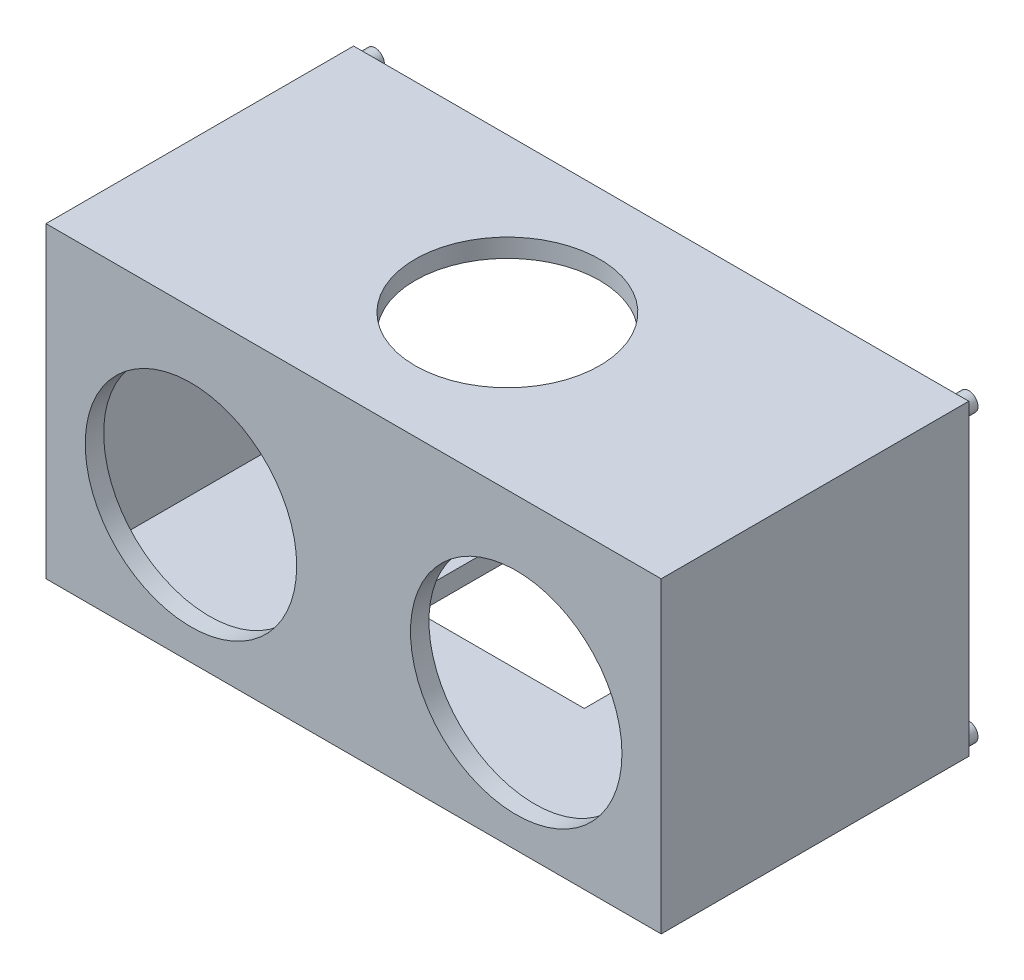
from build123d import *

# Parameters (mm, degrees)
SKETCH1_W               = 50.8
SKETCH1_H               = 25.4
BOSS_EXTRUDE1_DEPTH     = 25.4
SHELL1_T                = -1.524
SKETCH2_R               = 0.762
BOSS_EXTRUDE2_DEPTH     = 0.889
SKETCH3_W               = 15.24
SKETCH3_H               = 13.97
CUT_EXTRUDE1_DEPTH      = 23.876
SKETCH4_R               = 7.62
CUT_EXTRUDE2_DEPTH      = 23.876
CUT_EXTRUDE3_DEPTH      = 39.698340029
CUT_EXTRUDE3_DEPTH_BACK = 39.698340029
SKETCH5_R               = 8.73125


with BuildPart() as part:
    # Sketch1 → Boss-Extrude1 (new body)
    with BuildSketch(Plane.XY):
        Rectangle(SKETCH1_W, SKETCH1_H)
    extrude(amount=BOSS_EXTRUDE1_DEPTH)

    # Shell1
    shell1_openings = [part.faces().sort_by_distance(p)[0] for p in [
        (0, 0, 0),
    ]]
    offset(amount=SHELL1_T, openings=shell1_openings, kind=Kind.INTERSECTION)

    # Sketch2 → Boss-Extrude2 (add)
    with BuildSketch(Plane(origin=(0, 0, 0), x_dir=(-1, 0, 0), z_dir=(0, 0, -1))):
        with Locations(Location((-24.511, 11.811, 0), (0, 0, 180))):
            Circle(SKETCH2_R)
        with Locations(Location((24.511, 11.811, 0), (0, 0, 180))):
            Circle(SKETCH2_R)
        with Locations(Location((24.511, -11.811, 0), (0, 0, 180))):
            Circle(SKETCH2_R)
        with Locations(Location((-24.511, -11.811, 0), (0, 0, 180))):
            Circle(SKETCH2_R)
    extrude(amount=BOSS_EXTRUDE2_DEPTH)

    # Sketch3 → Cut-Extrude1 (cut)
    with BuildSketch(Plane(origin=(0, -12.7, 0), x_dir=(-1, 0, 0), z_dir=(0, -1, 0))):
        with Locations((0, -6.985)):
            Rectangle(SKETCH3_W, SKETCH3_H)
    extrude(amount=-CUT_EXTRUDE1_DEPTH, mode=Mode.SUBTRACT)

    # Sketch4 → Cut-Extrude2 (cut)
    with BuildSketch(Plane(origin=(0, 12.7, 0), x_dir=(1, 0, 0), z_dir=(0, 1, 0))):
        with Locations(Location((0, -12.7, 0), (0, 0, 270))):
            Circle(SKETCH4_R)
    extrude(amount=-CUT_EXTRUDE2_DEPTH, mode=Mode.SUBTRACT)

    # Sketch5 → Cut-Extrude3 (cut, two sides: drawn at the far end of the back side and taken through both)
    with BuildSketch(Plane.XY.offset(25.4).offset(-CUT_EXTRUDE3_DEPTH_BACK)):
        with Locations((-13.43025, -1.42875)):
            Circle(SKETCH5_R)
        with Locations((13.43025, -1.42875)):
            Circle(SKETCH5_R)
    extrude(amount=CUT_EXTRUDE3_DEPTH + CUT_EXTRUDE3_DEPTH_BACK, mode=Mode.SUBTRACT)


solid = part.part
